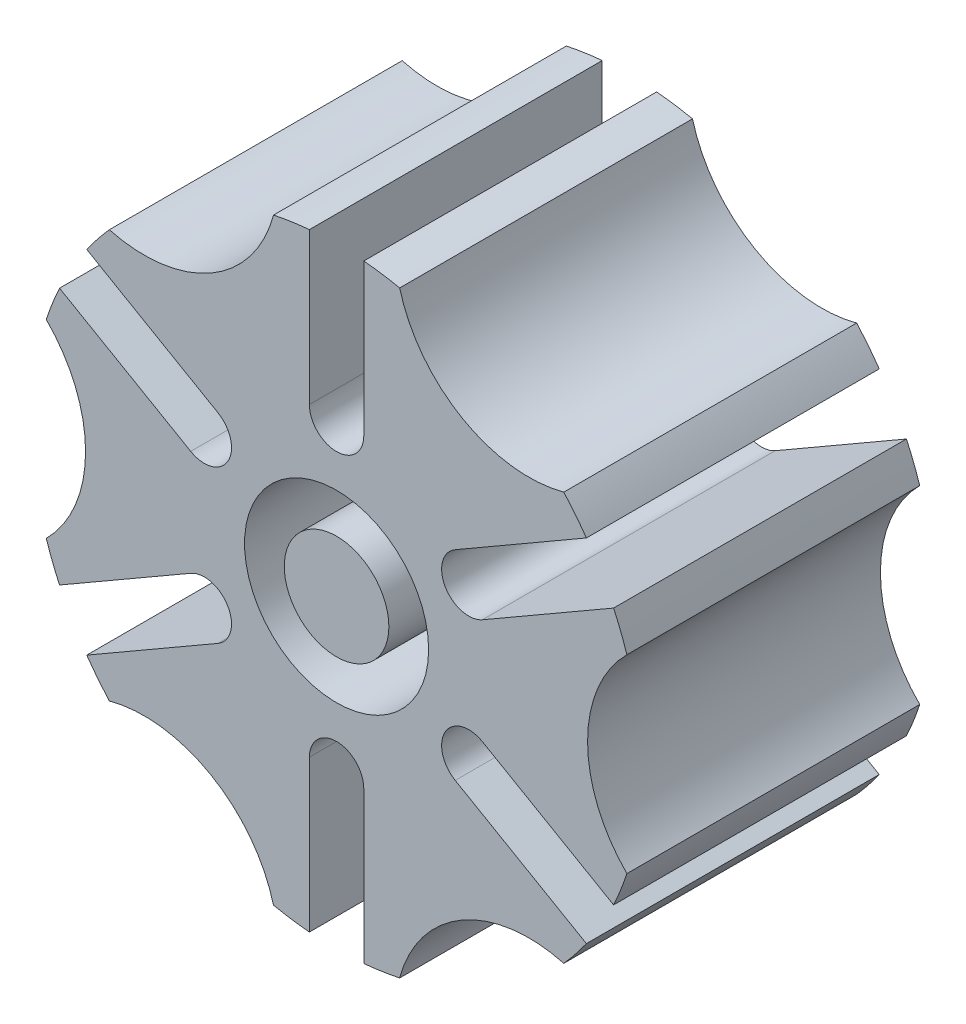
from build123d import *

# Parameters (mm, degrees)
RESSALTO_EXTRUS_O1_DEPTH        = 64
RESSALTO_EXTRUS_O1_DEPTH_BACK   = 6
ESBO_O1_R                       = 22
RESSALTO_EXTRUS_O1_2_DEPTH      = 64
RESSALTO_EXTRUS_O1_2_DEPTH_BACK = 6
ESBO_O1_R_2                     = 12.5


with BuildPart() as part:
    # Esboço1 → Ressalto-extrusão1 (new, two sides: drawn at the far end of the back side and taken through both)
    with BuildSketch(Plane.XY.offset(-RESSALTO_EXTRUS_O1_DEPTH_BACK)):
        with BuildLine():
            Line((6.5, 72.710040572), (6.5, 36.5))
            ThreePointArc((6.5, 36.5), (4.596194078, 31.903805922), (0, 30))
            ThreePointArc((0, 30), (-4.596194078, 31.903805922), (-6.5, 36.5))
            Line((-6.5, 36.5), (-6.5, 72.710040572))
            ThreePointArc((-6.5, 72.710040572), (-10.809885724, 72.195196313), (-15.081554111, 71.42511271))
            ThreePointArc((-15.081554111, 71.42511271), (-30, 51.961524227), (-54.315185019, 48.773565344))
            ThreePointArc((-54.315185019, 48.773565344), (-57.117931176, 45.459233805), (-59.718742246, 41.984185411))
            Line((-59.718742246, 41.984185411), (-28.359927238, 23.879165125))
            ThreePointArc((-28.359927238, 23.879165125), (-25.331409367, 19.932323793), (-25.980762114, 15))
            ThreePointArc((-25.980762114, 15), (-29.927603445, 11.971482129), (-34.859927238, 12.620834875))
            Line((-34.859927238, 12.620834875), (-66.218742246, 30.725855161))
            ThreePointArc((-66.218742246, 30.725855161), (-67.9278169, 26.735962507), (-69.39673913, 22.651547366))
            ThreePointArc((-69.39673913, 22.651547366), (-60, 0), (-69.39673913, -22.651547366))
            ThreePointArc((-69.39673913, -22.651547366), (-67.9278169, -26.735962507), (-66.218742246, -30.725855161))
            Line((-66.218742246, -30.725855161), (-34.859927238, -12.620834875))
            ThreePointArc((-34.859927238, -12.620834875), (-29.927603445, -11.971482129), (-25.980762114, -15))
            ThreePointArc((-25.980762114, -15), (-25.331409367, -19.932323793), (-28.359927238, -23.879165125))
            Line((-28.359927238, -23.879165125), (-59.718742246, -41.984185411))
            ThreePointArc((-59.718742246, -41.984185411), (-57.117931176, -45.459233805), (-54.315185019, -48.773565344))
            ThreePointArc((-54.315185019, -48.773565344), (-30, -51.961524227), (-15.081554111, -71.42511271))
            ThreePointArc((-15.081554111, -71.42511271), (-10.809885724, -72.195196313), (-6.5, -72.710040572))
            Line((-6.5, -72.710040572), (-6.5, -36.5))
            ThreePointArc((-6.5, -36.5), (-4.596194078, -31.903805922), (0, -30))
            ThreePointArc((0, -30), (4.596194078, -31.903805922), (6.5, -36.5))
            Line((6.5, -36.5), (6.5, -72.710040572))
            ThreePointArc((6.5, -72.710040572), (10.809885724, -72.195196313), (15.081554111, -71.42511271))
            ThreePointArc((15.081554111, -71.42511271), (30, -51.961524227), (54.315185019, -48.773565344))
            ThreePointArc((54.315185019, -48.773565344), (57.117931176, -45.459233805), (59.718742246, -41.984185411))
            Line((59.718742246, -41.984185411), (28.359927238, -23.879165125))
            ThreePointArc((28.359927238, -23.879165125), (25.331409367, -19.932323793), (25.980762114, -15))
            ThreePointArc((25.980762114, -15), (29.927603445, -11.971482129), (34.859927238, -12.620834875))
            Line((34.859927238, -12.620834875), (66.218742246, -30.725855161))
            ThreePointArc((66.218742246, -30.725855161), (67.9278169, -26.735962507), (69.39673913, -22.651547366))
            ThreePointArc((69.39673913, -22.651547366), (60, 0), (69.39673913, 22.651547366))
            ThreePointArc((69.39673913, 22.651547366), (67.9278169, 26.735962507), (66.218742246, 30.725855161))
            Line((66.218742246, 30.725855161), (34.859927238, 12.620834875))
            ThreePointArc((34.859927238, 12.620834875), (29.927603445, 11.971482129), (25.980762114, 15))
            ThreePointArc((25.980762114, 15), (25.331409367, 19.932323793), (28.359927238, 23.879165125))
            Line((28.359927238, 23.879165125), (59.718742246, 41.984185411))
            ThreePointArc((59.718742246, 41.984185411), (57.117931176, 45.459233805), (54.315185019, 48.773565344))
            ThreePointArc((54.315185019, 48.773565344), (30, 51.961524227), (15.081554111, 71.42511271))
            ThreePointArc((15.081554111, 71.42511271), (10.809885724, 72.195196313), (6.5, 72.710040572))
        make_face()
        Circle(ESBO_O1_R, mode=Mode.SUBTRACT)
    extrude(amount=RESSALTO_EXTRUS_O1_DEPTH + RESSALTO_EXTRUS_O1_DEPTH_BACK)


with BuildPart() as body_2:
    # Esboço1 → Ressalto-extrus_o1 2 (new, two sides: drawn at the far end of the back side and taken through both)
    with BuildSketch(Plane.XY.offset(-RESSALTO_EXTRUS_O1_2_DEPTH_BACK)):
        Circle(ESBO_O1_R_2)
    extrude(amount=RESSALTO_EXTRUS_O1_2_DEPTH + RESSALTO_EXTRUS_O1_2_DEPTH_BACK)


solid = Compound([part.part, body_2.part])
